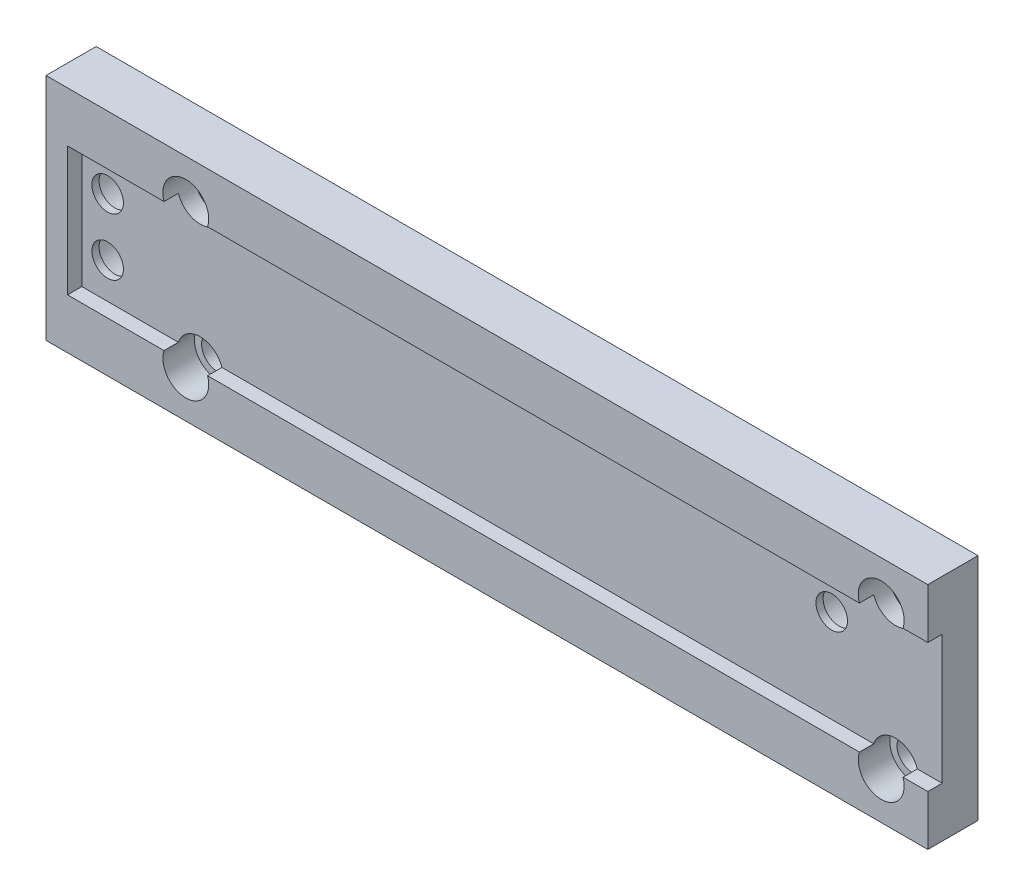
from build123d import *

# Parameters (mm, degrees)
SKETCH1_W           = 61.5
SKETCH1_H           = 16
BOSS_EXTRUDE1_DEPTH = 3.5
SKETCH5_W           = 60
SKETCH5_H           = 9
CUT_EXTRUDE3_DEPTH  = 1
SKETCH6_R           = 1.1
CUT_EXTRUDE4_DEPTH  = 32.871813566
SKETCH7_R           = 1.6
CUT_EXTRUDE5_DEPTH  = 2.2
SKETCH8_R           = 1.1
CUT_EXTRUDE6_DEPTH  = 32.871813566
SKETCH11_R          = 1.95
CUT_EXTRUDE10_DEPTH = 2


with BuildPart() as part:
    # Sketch1 → Boss-Extrude1 (new body)
    with BuildSketch(Plane.XY):
        Rectangle(SKETCH1_W, SKETCH1_H)
    extrude(amount=BOSS_EXTRUDE1_DEPTH)

    # Sketch5 → Cut-Extrude3 (cut)
    with BuildSketch(Plane.XY.offset(3.5)):
        with Locations((0.75, 0)):
            Rectangle(SKETCH5_W, SKETCH5_H)
    extrude(amount=-CUT_EXTRUDE3_DEPTH, mode=Mode.SUBTRACT)

    # Sketch6 → Cut-Extrude4 (cut, through all)
    with BuildSketch(Plane.XY.offset(2.5)):
        with Locations((-27.45, 2)):
            Circle(SKETCH6_R)
        with Locations((-27.45, -2)):
            Circle(SKETCH6_R)
        with Locations((23.05, 2)):
            Circle(SKETCH6_R)
    extrude(amount=-CUT_EXTRUDE4_DEPTH, mode=Mode.SUBTRACT)

    # Sketch7 → Cut-Extrude5 (cut)
    with BuildSketch(Plane.XY.offset(3.5)):
        with Locations((-21, 5)):
            Circle(SKETCH7_R)
        with Locations((-21, -5)):
            Circle(SKETCH7_R)
        with Locations((27.5, 5)):
            Circle(SKETCH7_R)
        with Locations((27.5, -5)):
            Circle(SKETCH7_R)
    extrude(amount=-CUT_EXTRUDE5_DEPTH, mode=Mode.SUBTRACT)

    # Sketch8 → Cut-Extrude6 (cut, through all)
    with BuildSketch(Plane.XY.offset(2.5)):
        with Locations((-21, 5)):
            Circle(SKETCH8_R)
        with Locations((-21, -5)):
            Circle(SKETCH8_R)
        with Locations((27.5, 5)):
            Circle(SKETCH8_R)
        with Locations((27.5, -5)):
            Circle(SKETCH8_R)
    extrude(amount=-CUT_EXTRUDE6_DEPTH, mode=Mode.SUBTRACT)

    # Sketch11 → Cut-Extrude10 (cut)
    with BuildSketch(Plane(origin=(0, 0, 0), x_dir=(-1, 0, 0), z_dir=(0, 0, -1))):
        with Locations((-23.05, 2)):
            Circle(SKETCH11_R)
        with Locations((27.45, -2)):
            Circle(SKETCH11_R)
        with Locations((27.45, 2)):
            Circle(SKETCH11_R)
    extrude(amount=-CUT_EXTRUDE10_DEPTH, mode=Mode.SUBTRACT)


solid = part.part
